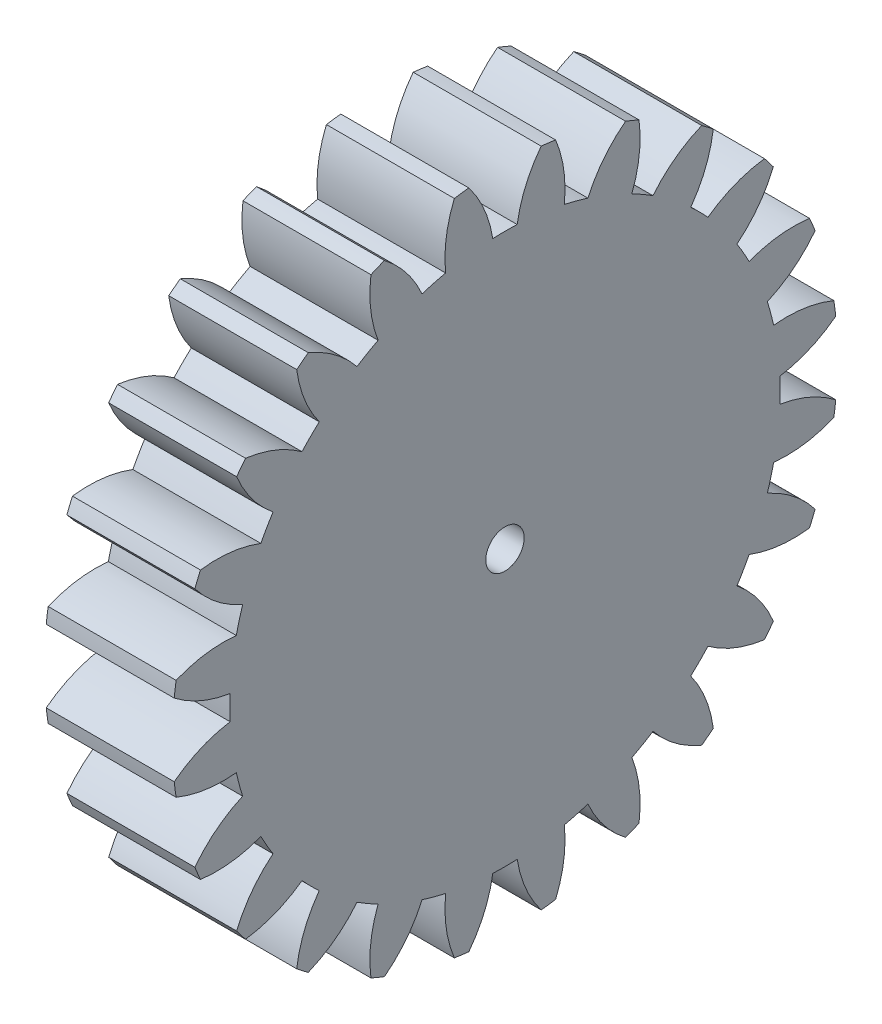
from build123d import *

# Parameters (mm, degrees)
BASPROSKE_W     = 10
BASPROSKE_H     = 26
TOOTHCUT_DEPTH  = 39.105117767
TEETHCUTS_COUNT = 24
TEETHCUTS_ANGLE = 345
BORSKE_R        = 1.5
BORE_DEPTH      = 50.0000508


with BuildPart() as part:
    # BasProSke → Base-Revolve (revolve)
    with BuildSketch(Plane(origin=(0, 0, 0), x_dir=(1, 0, 0), z_dir=(0, 1, 0)), mode=Mode.PRIVATE) as base_revolve_sk:
        with Locations((5, 13)):
            Rectangle(BASPROSKE_W, BASPROSKE_H)
    revolve(base_revolve_sk.sketch.rotate(Axis((-10, 0, 0), (1, 0, 0)), 180), axis=Axis((-10, 0, 0), (1, 0, 0)))

    # TooCutSke → ToothCut (cut, through all)
    with BuildSketch(Plane(origin=(0, 0, 0), x_dir=(0, 0, -1), z_dir=(1, 0, 0))):
        with BuildLine():
            ThreePointArc((0.952932849, 21.477870471), (0, 21.499), (-0.952932849, 21.477870471))
            ThreePointArc((-0.952932849, 21.477870471), (-1.621910648, 23.79336664), (-2.846540061, 25.86926081))
            ThreePointArc((-2.846540061, 25.86926081), (0, 26.0254), (2.846540061, 25.86926081))
            ThreePointArc((2.846540061, 25.86926081), (1.621910648, 23.79336664), (0.952932849, 21.477870471))
        make_face()
    toothcut = extrude(amount=TOOTHCUT_DEPTH, mode=Mode.SUBTRACT)

    # TeethCuts: ToothCut ×24 about axis
    teethcuts_axis = Axis((-10, 0, 0), (1, 0, 0))
    for i in range(1, TEETHCUTS_COUNT):
        add(toothcut.rotate(teethcuts_axis, i * TEETHCUTS_ANGLE / (TEETHCUTS_COUNT - 1)), mode=Mode.SUBTRACT)

    # BorSke → Bore (cut, symmetric)
    with BuildSketch(Plane(origin=(0, 0, 0), x_dir=(0, 0, -1), z_dir=(1, 0, 0))):
        with Locations(Location((0, 0, 0), (0, 0, 180))):
            Circle(BORSKE_R)
    extrude(amount=BORE_DEPTH, both=True, mode=Mode.SUBTRACT)


solid = part.part
